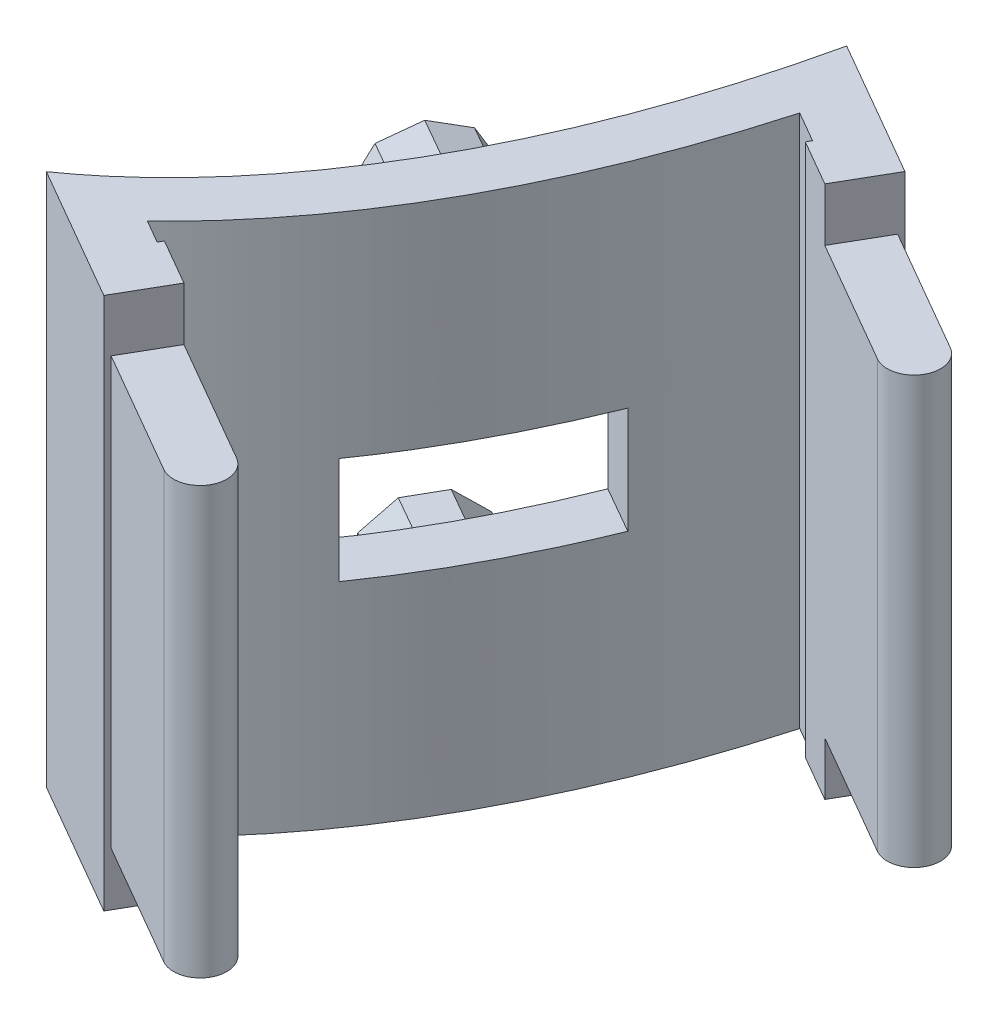
from build123d import *

# Parameters (mm, degrees)
BOSS_EXTRUDE1_DEPTH      = 50
SHELL1_T                 = -5
BOSS_EXTRUDE2_DEPTH      = 5.500000000000001
BOSS_EXTRUDE2_DEPTH_BACK = 7.5
CUT_EXTRUDE1_DEPTH       = 10
SKETCH5_W                = 16
SKETCH5_H                = 5
CUT_EXTRUDE2_DEPTH       = 121.69448930041943
FILLET2_RADIUS           = 2.5
FILLET2_LENGTH           = 40
FILLET3_RADIUS           = 2.5
FILLET3_LENGTH           = 40


with BuildPart() as part:
    # Sketch2 → Boss-Extrude1 (new body)
    with BuildSketch(Plane(origin=(0, 0, 0), x_dir=(1, 0, 0), z_dir=(0, 1, 0))):
        with BuildLine():
            Line((18.78053977456615, -77.31409286467196), (23.042995642351375, -79.77502290734665))
            Line((23.042995642351375, -79.77502290734665), (31.523043656078794, -84.67098091081314))
            Line((31.523043656078794, -84.67098091081314), (31.773043656078798, -84.23796820892092))
            Line((31.773043656078798, -84.23796820892092), (45.62945011662982, -92.23796820892092))
            Line((45.62945011662982, -92.23796820892092), (72.62945011662983, -45.4725964045612))
            Line((72.62945011662983, -45.4725964045612), (58.773043656078805, -37.472596404561216))
            Line((58.773043656078805, -37.472596404561216), (59.0230436560788, -37.039583702669006))
            Line((59.0230436560788, -37.039583702669006), (50.362789618234416, -32.03958370266901))
            Line((50.362789618234416, -32.03958370266901), (46.10033375044919, -29.578653659994334))
            add(Edge.make_bspline(
                [(18.78053977456615, -77.31409286467196), (38.540581097928744, -63.49650278099066), (46.10033375044919, -29.578653659994334)],
                knots=[3.5325222979989195, 3.5325222979989195, 3.5325222979989195, 4.350849853477907, 4.350849853477907, 4.350849853477907], degree=2, weights=[1, 0.9174538281146124, 1]))
        make_face()
    extrude(amount=BOSS_EXTRUDE1_DEPTH)

    # Shell1
    shell1_openings = [part.faces().sort_by_distance(p)[0] for p in [
        (47.213884273, 50, 61.782899624),
        (47.213884273, 0, 61.782899624),
        (59.129450117, 25, 68.855282307),
    ]]
    offset(amount=SHELL1_T, openings=shell1_openings, kind=Kind.INTERSECTION)

    # Sketch3 → Boss-Extrude2 (add, two sides: drawn at the far end of the back side and taken through both)
    with BuildSketch(Plane(origin=(47.47757848615084, 0, 27.172215953725974), x_dir=(-0.4967199718961618, 0, 0.8679108649622244), z_dir=(-0.8679108649622244, 0, -0.4967199718961618)).offset(-BOSS_EXTRUDE2_DEPTH_BACK)):
        Polygon((25.664850284699074, 37.339555568810255), (28.453024038902463, 35.000000000000014), (32.09272638156445, 35.000000000000014), (34.8809001357678, 37.339555568810226), (35.51292781482111, 40.92396265452046), (33.69307664349011, 44.07603734547951), (30.272875210233437, 45.320888862379554), (26.852673776976776, 44.07603734547953), (25.03282260564577, 40.923962654520494), align=None)
        Polygon((33.69307664349011, 5.923962654520468), (35.51292781482114, 9.07603734547954), (34.880900135767824, 12.660444431189784), (32.09272638156446, 15.000000000000004), (28.453024038902413, 15.000000000000004), (25.664850284699046, 12.660444431189786), (25.032822605645727, 9.07603734547953), (26.852673776976744, 5.9239626545204755), (30.272875210233433, 4.679111137620436), align=None)
    extrude(amount=BOSS_EXTRUDE2_DEPTH + BOSS_EXTRUDE2_DEPTH_BACK)

    # Sketch4 → Cut-Extrude1 (cut)
    with BuildSketch(Plane(origin=(47.47757848615084, 0, 27.172215953725974), x_dir=(-0.4967199718961618, 0, 0.8679108649622244), z_dir=(-0.8679108649622244, 0, -0.4967199718961618))):
        Polygon((40.272875210233444, 19.999999999999996), (20.27287521023344, 19.999999999999993), (20.27287521023344, 30), (40.272875210233444, 30.000000000000007), align=None)
    extrude(amount=-CUT_EXTRUDE1_DEPTH, mode=Mode.SUBTRACT)

    # Sketch5 → Cut-Extrude2 (cut, through all)
    with BuildSketch(Plane(origin=(-28.532849302036027, 0, 49.420344675832624), x_dir=(0.8660254037844389, 0, 0.49999999999999967), z_dir=(-0.49999999999999967, 0, 0.8660254037844389))):
        with Locations((77.63524706617667, 47.50000000000001)):
            Rectangle(SKETCH5_W, SKETCH5_H)
        Polygon((69.63524706617666, 0), (85.63524706617667, 0), (85.63524706617667, 5), (69.63524706617667, 4.999999999999997), align=None)
    extrude(amount=-CUT_EXTRUDE2_DEPTH, mode=Mode.SUBTRACT)

    # Fillet2: full round fillet: the end face becomes a half cylinder, R = half its width
    fillet2_face = Plane((46.879450117, 25, 90.072904699), x_dir=(0, 1, 0), z_dir=(0.866025403784, 0, 0.5))  # on the end face: x along it, z out of the body
    fillet2_slab = fillet2_face.offset(-FILLET2_RADIUS / 2) * Box(FILLET2_LENGTH, 2 * FILLET2_RADIUS, FILLET2_RADIUS, mode=Mode.PRIVATE)  # the body's end, R deep
    fillet2_round = Plane((44.71438660754, 25, 88.822904699), x_dir=(0.866025403784, 0, 0.5), z_dir=(0, 1, 0)) * Cylinder(FILLET2_RADIUS, FILLET2_LENGTH, mode=Mode.PRIVATE)  # its axis R under the face
    add(fillet2_slab - fillet2_round, mode=Mode.SUBTRACT)

    # Fillet3: full round fillet: the end face becomes a half cylinder, R = half its width
    fillet3_face = Plane((71.379450117, 25, 47.637659914), x_dir=(0, -1, 0), z_dir=(0.866025403784, 0, 0.5))  # on the end face: x along it, z out of the body
    fillet3_slab = fillet3_face.offset(-FILLET3_RADIUS / 2) * Box(FILLET3_LENGTH, 2 * FILLET3_RADIUS, FILLET3_RADIUS, mode=Mode.PRIVATE)  # the body's end, R deep
    fillet3_round = Plane((69.21438660754, 25, 46.387659914), x_dir=(0.866025403784, 0, 0.5), z_dir=(0, -1, 0)) * Cylinder(FILLET3_RADIUS, FILLET3_LENGTH, mode=Mode.PRIVATE)  # its axis R under the face
    add(fillet3_slab - fillet3_round, mode=Mode.SUBTRACT)


solid = part.part
